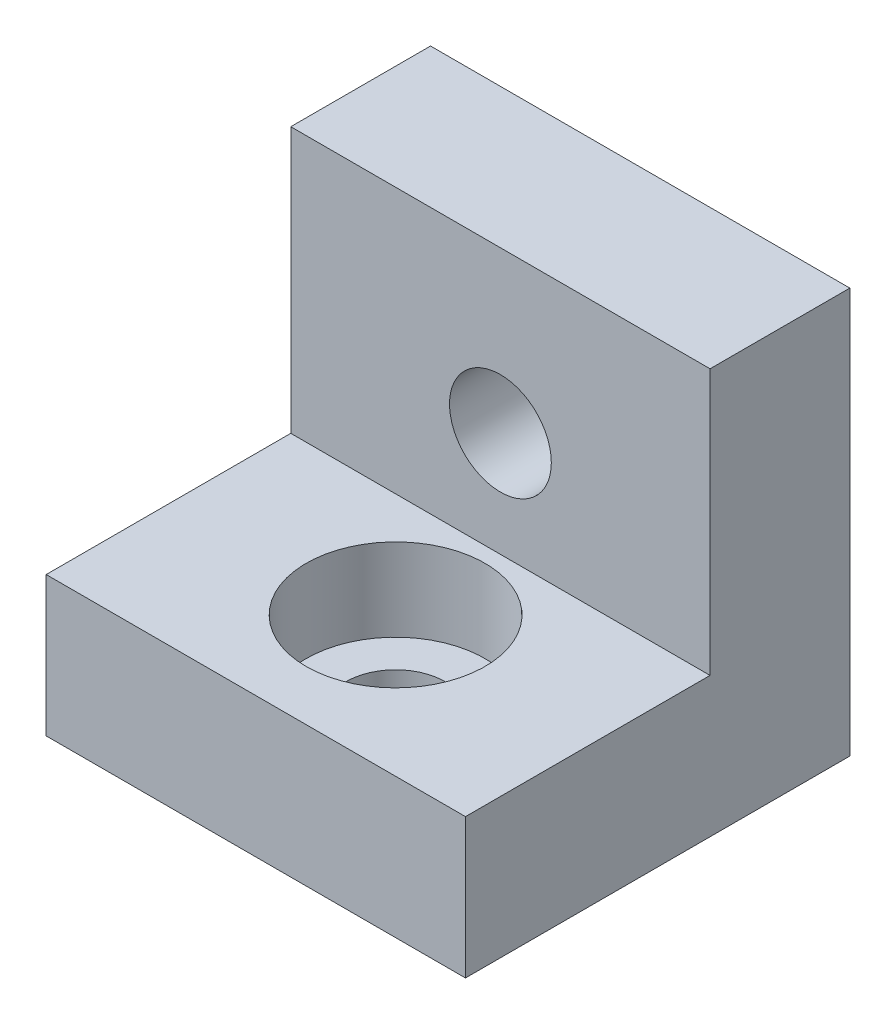
from build123d import *

# Parameters (mm, degrees)
SKETCH1_W                      = 15.24
SKETCH1_H                      = 13.97
BOSS_EXTRUDE1_DEPTH            = 5.08
SKETCH2_W                      = 15.24
SKETCH2_H                      = 5.08
BOSS_EXTRUDE2_DEPTH            = 9.652
M3_CLEARANCE_HOLE1_D           = 3.7
M3_CLEARANCE_HOLE1_DEPTH       = 25.4
M3_CLEARANCE_HOLE1_TIP         = 1.111592145
CBORE_FOR_M3_SHCS2_D           = 3.6
CBORE_FOR_M3_SHCS2_DEPTH       = 25.4
CBORE_FOR_M3_SHCS2_CBORE_D     = 6.5
CBORE_FOR_M3_SHCS2_CBORE_DEPTH = 3
CBORE_FOR_M3_SHCS2_TIP         = 1.081549114


with BuildPart() as part:
    # Sketch1 → Boss-Extrude1 (new body)
    with BuildSketch(Plane(origin=(0, 0, 0), x_dir=(1, 0, 0), z_dir=(0, 1, 0))):
        with Locations((0.762, 3.81)):
            Rectangle(SKETCH1_W, SKETCH1_H)
    extrude(amount=BOSS_EXTRUDE1_DEPTH)

    # Sketch2 → Boss-Extrude2 (add)
    with BuildSketch(Plane(origin=(0, 5.08, 0), x_dir=(1, 0, 0), z_dir=(0, 1, 0))):
        with Locations((0.762, 8.255)):
            Rectangle(SKETCH2_W, SKETCH2_H)
    extrude(amount=BOSS_EXTRUDE2_DEPTH)

    # M3 Clearance Hole1
    with Locations(Plane.XY.offset(-5.715)):
        with Locations((0.762, 8.89)):
            Hole(M3_CLEARANCE_HOLE1_D / 2, depth=M3_CLEARANCE_HOLE1_DEPTH)
            with Locations((0, 0, -(M3_CLEARANCE_HOLE1_DEPTH + M3_CLEARANCE_HOLE1_TIP / 2))):  # 118° drill point
                Cone(0, M3_CLEARANCE_HOLE1_D / 2, M3_CLEARANCE_HOLE1_TIP, mode=Mode.SUBTRACT)

    # CBORE for M3 SHCS2
    with Locations(Plane(origin=(0, 5.08, 0), x_dir=(1, 0, 0), z_dir=(0, 1, 0))):
        with Locations((0.762, 1.905)):
            CounterBoreHole(CBORE_FOR_M3_SHCS2_D / 2, CBORE_FOR_M3_SHCS2_CBORE_D / 2, CBORE_FOR_M3_SHCS2_CBORE_DEPTH, depth=CBORE_FOR_M3_SHCS2_DEPTH)
            with Locations((0, 0, -(CBORE_FOR_M3_SHCS2_DEPTH + CBORE_FOR_M3_SHCS2_TIP / 2))):  # 118° drill point
                Cone(0, CBORE_FOR_M3_SHCS2_D / 2, CBORE_FOR_M3_SHCS2_TIP, mode=Mode.SUBTRACT)


solid = part.part
